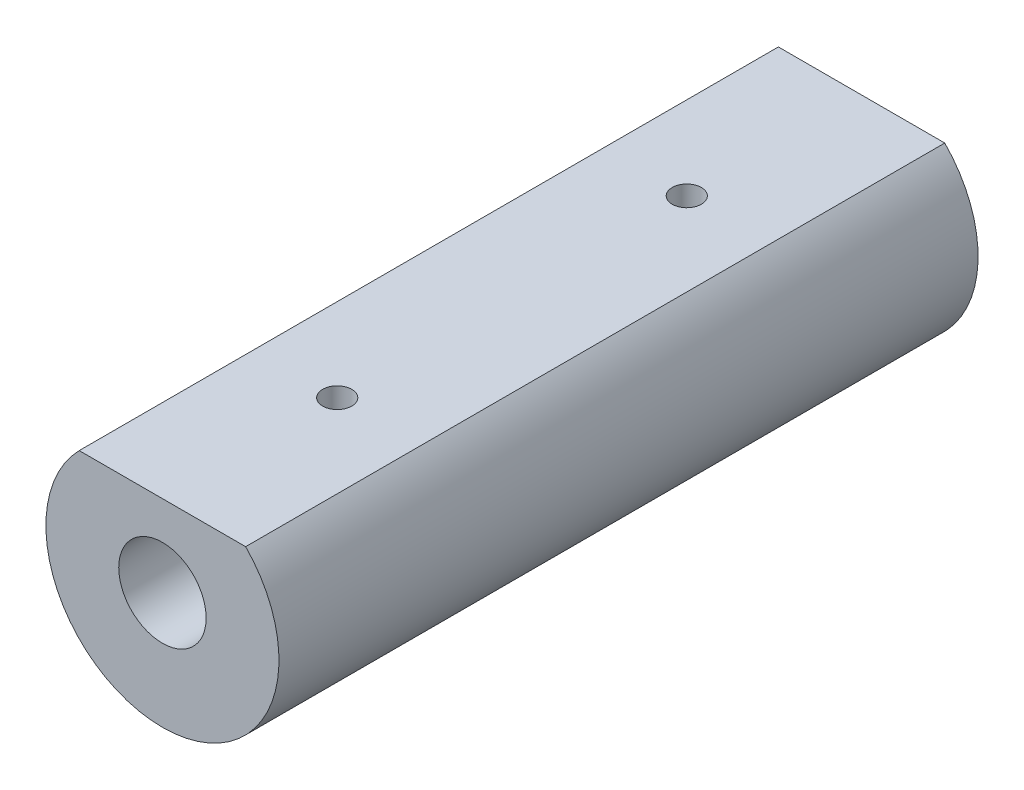
from build123d import *

# Parameters (mm, degrees)
SKETCH1_R               = 10
BOSS_EXTRUDE1_DEPTH     = 60
CUT_EXTRUDE1_REACH      = 63.644
SKETCH2_R               = 3.75
CUT_EXTRUDE2_REACH      = 65.159
CUT_EXTRUDE2_END_RADIUS = 3.75
SKETCH3_R               = 1.25


with BuildPart() as part:
    # Sketch1 → Boss-Extrude1 (new body)
    with BuildSketch(Plane.XY):
        Circle(SKETCH1_R)
    extrude(amount=BOSS_EXTRUDE1_DEPTH)

    # Sketch2 → Cut-Extrude1 (cut, up to next)
    with BuildSketch(Plane(origin=(0, 0, 0), x_dir=(-1, 0, 0), z_dir=(0, 0, -1)), mode=Mode.PRIVATE) as cut_extrude1_sk1:
        Circle(SKETCH2_R)
    cut_extrude1_tool1 = extrude(cut_extrude1_sk1.sketch, amount=-CUT_EXTRUDE1_REACH, mode=Mode.PRIVATE) & part.part
    # Sketch2 → Cut-Extrude1 (cut, up to next)
    with BuildSketch(Plane(origin=(0, 0, 0), x_dir=(-1, 0, 0), z_dir=(0, 0, -1)), mode=Mode.PRIVATE) as cut_extrude1_sk2:
        with BuildLine():
            Line((-7.141428429, 7), (7.141428429, 7))
            ThreePointArc((7.141428429, 7), (0, 10), (-7.141428429, 7))
        make_face()
    cut_extrude1_tool2 = extrude(cut_extrude1_sk2.sketch, amount=-CUT_EXTRUDE1_REACH, mode=Mode.PRIVATE) & part.part
    add(cut_extrude1_tool1.solids().sort_by_distance((0, 0, 0))[0], mode=Mode.SUBTRACT)
    add(cut_extrude1_tool2.solids().sort_by_distance((0, 8.216904, 0))[0], mode=Mode.SUBTRACT)

    # Cut-Extrude2: up to this cylinder (the profile starts outside it)
    cut_extrude2_end = Plane(origin=(0, 0, 30), z_dir=(0, 0, -1)) * Cylinder(CUT_EXTRUDE2_END_RADIUS, 168.818, mode=Mode.PRIVATE)
    # Sketch3 → Cut-Extrude2 (cut, up to the surface)
    with BuildSketch(Plane(origin=(0, 7, 0), x_dir=(1, 0, 0), z_dir=(0, 1, 0)), mode=Mode.PRIVATE) as cut_extrude2_sk1:
        with Locations(Location((0, -15, 0), (0, 0, 270))):
            Circle(SKETCH3_R)
    cut_extrude2_tool1 = extrude(cut_extrude2_sk1.sketch, amount=-CUT_EXTRUDE2_REACH, mode=Mode.PRIVATE) - cut_extrude2_end
    add(cut_extrude2_tool1.solids().sort_by_distance((0, 7, 15))[0], mode=Mode.SUBTRACT)
    # Sketch3 → Cut-Extrude2 (cut, up to the surface)
    with BuildSketch(Plane(origin=(0, 7, 0), x_dir=(1, 0, 0), z_dir=(0, 1, 0)), mode=Mode.PRIVATE) as cut_extrude2_sk2:
        with Locations(Location((0, -45, 0), (0, 0, 270))):
            Circle(SKETCH3_R)
    cut_extrude2_tool2 = extrude(cut_extrude2_sk2.sketch, amount=-CUT_EXTRUDE2_REACH, mode=Mode.PRIVATE) - cut_extrude2_end
    add(cut_extrude2_tool2.solids().sort_by_distance((0, 7, 45))[0], mode=Mode.SUBTRACT)


solid = part.part
